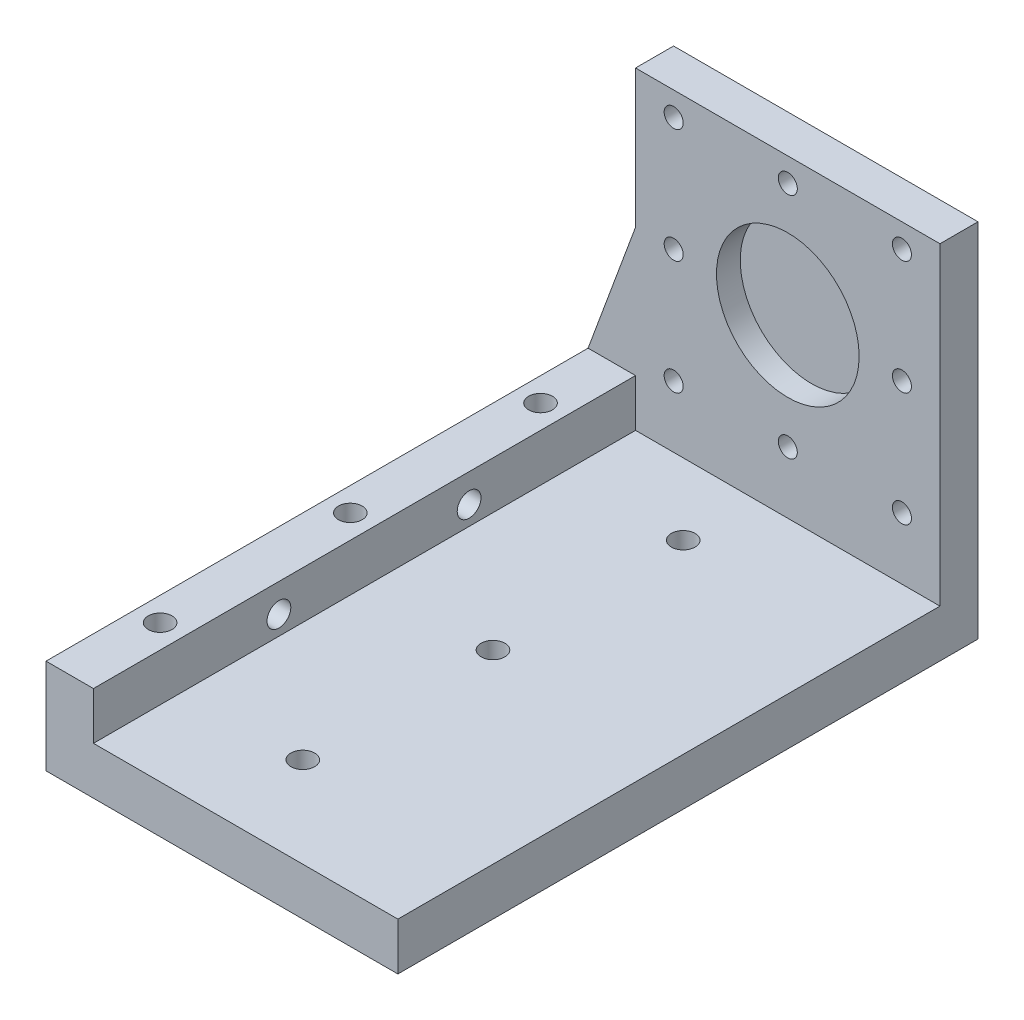
from build123d import *

# Parameters (mm, degrees)
SKETCH1_W           = 58
SKETCH1_H           = 58
SKETCH1_R           = 2
BOSS_EXTRUDE1_DEPTH = 8
SKETCH13_R          = 15
CUT_EXTRUDE5_DEPTH  = 5
BOSS_EXTRUDE7_DEPTH = 8
SKETCH21_W          = 84
SKETCH21_H          = 10
BOSS_EXTRUDE8_DEPTH = 114
SKETCH22_W          = 9.98
SKETCH22_H          = 9.98
BOSS_EXTRUDE9_DEPTH = 114
SKETCH29_W          = 20
SKETCH29_H          = 6
CUT_EXTRUDE6_DEPTH  = 40
SKETCH30_W          = 10
SKETCH30_H          = 76
CUT_EXTRUDE7_DEPTH  = 138.320792308
SKETCH31_R          = 2.5
CUT_EXTRUDE8_DEPTH  = 4
SKETCH34_R          = 2.5
CUT_EXTRUDE9_DEPTH  = 10
SKETCH36_R          = 2.5
CUT_EXTRUDE10_DEPTH = 20
CUT_EXTRUDE12_DEPTH = 15


with BuildPart() as part:
    # Sketch1 → Boss-Extrude1 (new body)
    with BuildSketch(Plane.XY):
        Rectangle(SKETCH1_W, SKETCH1_H)
        with Locations((0, 24)):
            Circle(SKETCH1_R, mode=Mode.SUBTRACT)
        with Locations((-24, 24)):
            Circle(SKETCH1_R, mode=Mode.SUBTRACT)
        with Locations((24, 0)):
            Circle(SKETCH1_R, mode=Mode.SUBTRACT)
        with Locations((0, -24)):
            Circle(SKETCH1_R, mode=Mode.SUBTRACT)
        with Locations((-24, 0)):
            Circle(SKETCH1_R, mode=Mode.SUBTRACT)
        with Locations(Location((24, -24, 0), (0, 0, 180))):
            Circle(SKETCH1_R, mode=Mode.SUBTRACT)
        with Locations((24, 24)):
            Circle(SKETCH1_R, mode=Mode.SUBTRACT)
        with Locations(Location((-24, -24, 0), (0, 0, 180))):
            Circle(SKETCH1_R, mode=Mode.SUBTRACT)
    extrude(amount=BOSS_EXTRUDE1_DEPTH)

    # Sketch13 → Cut-Extrude5 (cut)
    with BuildSketch(Plane.XY.offset(8)):
        Circle(SKETCH13_R)
    extrude(amount=-CUT_EXTRUDE5_DEPTH, mode=Mode.SUBTRACT)

    # Sketch15 → Boss-Extrude7 (add)
    with BuildSketch(Plane.XY):
        Polygon((29, -29), (-29, -29), (-29, 29), (-42, 29), (-42, -29), (-42, -47), (42, -47), (42, -29), (42, 29), (29, 29), align=None)
    extrude(amount=BOSS_EXTRUDE7_DEPTH)

    # Sketch21 → Boss-Extrude8 (add)
    with BuildSketch(Plane.XY.offset(8)):
        with Locations((0, -42)):
            Rectangle(SKETCH21_W, SKETCH21_H)
    extrude(amount=BOSS_EXTRUDE8_DEPTH)

    # Sketch22 → Boss-Extrude9 (add)
    with BuildSketch(Plane.XY.offset(8)):
        with Locations((-37.01, -32.01)):
            Rectangle(SKETCH22_W, SKETCH22_H)
    extrude(amount=BOSS_EXTRUDE9_DEPTH)

    # Sketch29 → Cut-Extrude6 (cut)
    with BuildSketch(Plane.ZY.offset(42)):
        with Locations((103, -44)):
            Rectangle(SKETCH29_W, SKETCH29_H)
        with Locations((63, -44)):
            Rectangle(SKETCH29_W, SKETCH29_H)
        with Locations((23, -44)):
            Rectangle(SKETCH29_W, SKETCH29_H)
    extrude(amount=-CUT_EXTRUDE6_DEPTH, mode=Mode.SUBTRACT)

    # Sketch30 → Cut-Extrude7 (cut, through all)
    with BuildSketch(Plane.XY.offset(122)):
        with Locations((37, -9)):
            Rectangle(SKETCH30_W, SKETCH30_H)
    extrude(amount=-CUT_EXTRUDE7_DEPTH, mode=Mode.SUBTRACT)

    # Sketch31 → Cut-Extrude8 (cut)
    with BuildSketch(Plane.XZ.offset(41)):
        with Locations(Location((-7, 103, 0), (0, 0, 270))):
            Circle(SKETCH31_R)
        with Locations(Location((-7, 63, 0), (0, 0, 90))):
            Circle(SKETCH31_R)
        with Locations(Location((-7, 23, 0), (0, 0, 270))):
            Circle(SKETCH31_R)
    extrude(amount=-CUT_EXTRUDE8_DEPTH, mode=Mode.SUBTRACT)

    # Sketch34 → Cut-Extrude9 (cut)
    with BuildSketch(Plane.ZY.offset(42)):
        with Locations((43, -33)):
            Circle(SKETCH34_R)
        with Locations((83, -33)):
            Circle(SKETCH34_R)
    extrude(amount=-CUT_EXTRUDE9_DEPTH, mode=Mode.SUBTRACT)

    # Sketch36 → Cut-Extrude10 (cut)
    with BuildSketch(Plane.XZ.offset(41)):
        with Locations(Location((-37, 103, 0), (0, 0, 270))):
            Circle(SKETCH36_R)
        with Locations(Location((-37, 23, 0), (0, 0, 270))):
            Circle(SKETCH36_R)
        with Locations(Location((-37, 63, 0), (0, 0, 270))):
            Circle(SKETCH36_R)
    extrude(amount=-CUT_EXTRUDE10_DEPTH, mode=Mode.SUBTRACT)

    # Sketch37 → Cut-Extrude12 (cut)
    with BuildSketch(Plane.XY.offset(8)):
        Polygon((-42, -27.02), (-32.02, 0), (-32.02, 29), (-42, 29), align=None)
    extrude(amount=-CUT_EXTRUDE12_DEPTH, mode=Mode.SUBTRACT)


solid = part.part
